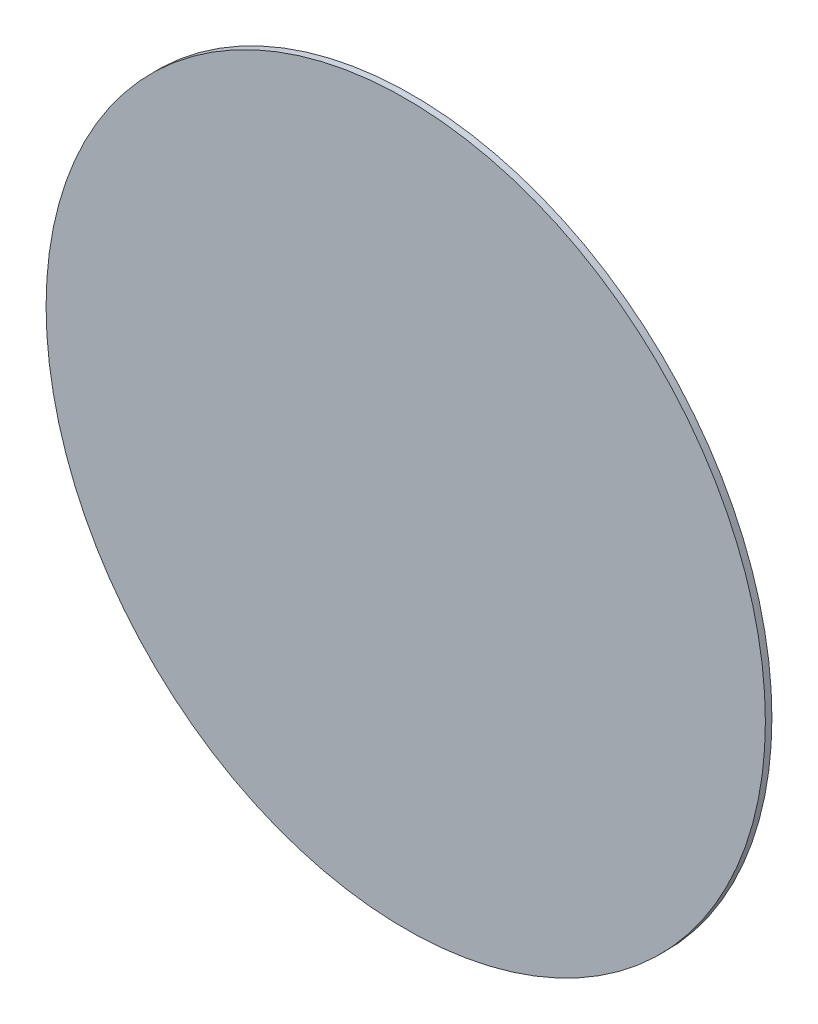
from build123d import *

# Parameters (mm, degrees)
SKETCH_2_R      = 550
EXTRUDE_2_DEPTH = 10


with BuildPart() as part:
    # Эскиз2 → Бобышка-Вытянуть2 (new body)
    with BuildSketch(Plane.XY):
        Circle(SKETCH_2_R)
    extrude(amount=EXTRUDE_2_DEPTH)


solid = part.part
